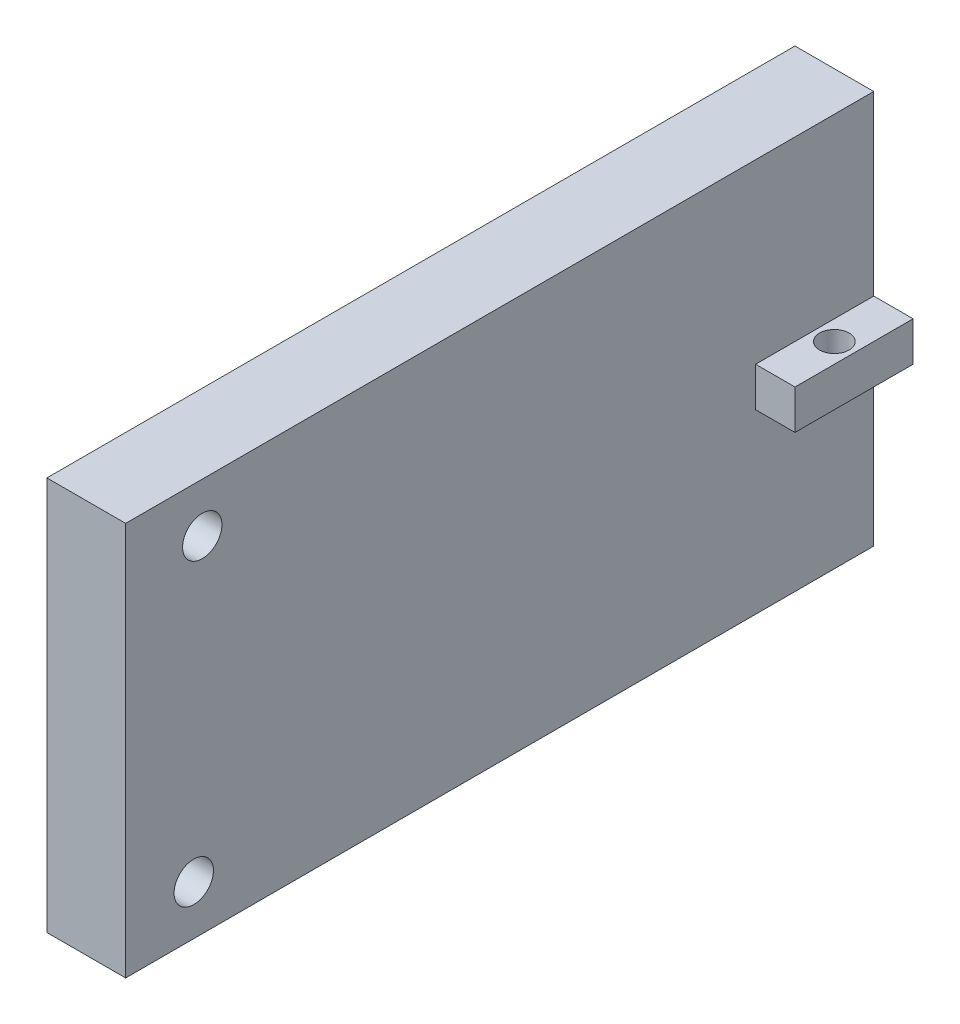
from build123d import *

# Parameters (mm, degrees)
SKETCH3_W           = 965.2
SKETCH3_H           = 508
BOSS_EXTRUDE2_DEPTH = 101.6
SKETCH4_R           = 25.4
CUT_EXTRUDE2_DEPTH  = 101.6
SKETCH7_W           = 152.4
SKETCH7_H           = 50.8
BOSS_EXTRUDE4_DEPTH = 152.4
SKETCH10_R          = 19.05
CUT_EXTRUDE3_DEPTH  = 609.6


with BuildPart() as part:
    # Sketch3 → Boss-Extrude2 (new body)
    with BuildSketch(Plane(origin=(0, 0, 0), x_dir=(0, 0, -1), z_dir=(1, 0, 0))):
        with Locations((232.546367736, 490.753272684)):
            Rectangle(SKETCH3_W, SKETCH3_H)
    extrude(amount=BOSS_EXTRUDE2_DEPTH)

    # Sketch4 → Cut-Extrude2 (cut)
    with BuildSketch(Plane(origin=(0, 0, 0), x_dir=(0, 0, -1), z_dir=(1, 0, 0))):
        with Locations((-151.217224275, 681.253272684)):
            Circle(SKETCH4_R)
        with Locations((-162.181898332, 300.253272684)):
            Circle(SKETCH4_R)
    extrude(amount=CUT_EXTRUDE2_DEPTH, mode=Mode.SUBTRACT)

    # Sketch7 → Boss-Extrude4 (add)
    with BuildSketch(Plane(origin=(0, 0, 0), x_dir=(0, 0, -1), z_dir=(1, 0, 0))):
        with Locations((638.946367736, 490.753272684)):
            Rectangle(SKETCH7_W, SKETCH7_H)
    extrude(amount=BOSS_EXTRUDE4_DEPTH)

    # Sketch10 → Cut-Extrude3 (cut)
    with BuildSketch(Plane(origin=(0, 0, 0), x_dir=(1, 0, 0), z_dir=(0, 1, 0))):
        with Locations(Location((127, 638.946367736, 0), (0, 0, 90))):
            Circle(SKETCH10_R)
    extrude(amount=CUT_EXTRUDE3_DEPTH, mode=Mode.SUBTRACT)


solid = part.part
